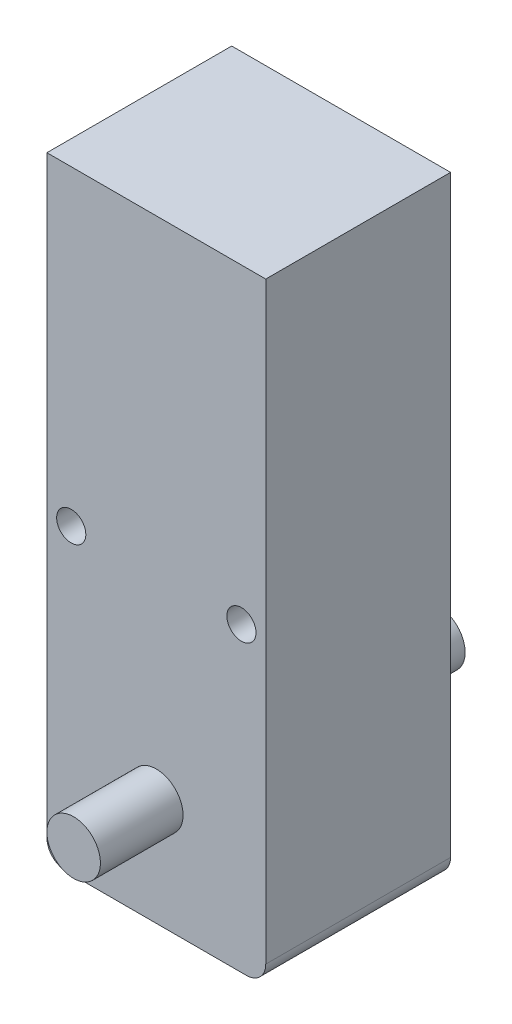
from build123d import *

# Parameters (mm, degrees)
SKETCH1_W                = 22.5
SKETCH1_H                = 19
BOSS_EXTRUDE1_DEPTH      = 63
FILLET1_R                = 2
BOSS_EXTRUDE2_DEPTH      = 10
BOSS_EXTRUDE2_DEPTH_BACK = 27.5
SKETCH2_R                = 2.75
SKETCH3_W                = 5
SKETCH3_H                = 3
BOSS_EXTRUDE3_DEPTH      = 6
SKETCH4_R                = 1.5
CUT_EXTRUDE1_DEPTH       = 10
SKETCH5_R                = 1.5
CUT_EXTRUDE2_DEPTH       = 73.912618935


with BuildPart() as part:
    # Sketch1 → Boss-Extrude1 (new body)
    with BuildSketch(Plane(origin=(0, 0, 0), x_dir=(1, 0, 0), z_dir=(0, 1, 0))):
        with Locations((11.25, 9.5)):
            Rectangle(SKETCH1_W, SKETCH1_H)
    extrude(amount=BOSS_EXTRUDE1_DEPTH)

    # Fillet1
    fillet1_edges = [part.edges().sort_by_distance(p)[0] for p in [
        (22.5, 0, -9.5),
        (0, 0, -9.5),
    ]]
    fillet(fillet1_edges, radius=FILLET1_R)

    # Sketch2 → Boss-Extrude2 (add, two sides: drawn at the far end of the back side and taken through both)
    with BuildSketch(Plane(origin=(0, 0, -19), x_dir=(-1, 0, 0), z_dir=(0, 0, -1)).offset(-BOSS_EXTRUDE2_DEPTH_BACK)):
        with Locations((-11.25, 11)):
            Circle(SKETCH2_R)
    extrude(amount=BOSS_EXTRUDE2_DEPTH + BOSS_EXTRUDE2_DEPTH_BACK)

    # Sketch3 → Boss-Extrude3 (add)
    with BuildSketch(Plane.XZ):
        with Locations((11.25, -8.517818065)):
            Rectangle(SKETCH3_W, SKETCH3_H)
    extrude(amount=BOSS_EXTRUDE3_DEPTH)

    # Sketch4 → Cut-Extrude1 (cut)
    with BuildSketch(Plane(origin=(0, 0, -10.017818065), x_dir=(-1, 0, 0), z_dir=(0, 0, -1))):
        with Locations((-11.25, -3)):
            Circle(SKETCH4_R)
    extrude(amount=-CUT_EXTRUDE1_DEPTH, mode=Mode.SUBTRACT)

    # Sketch5 → Cut-Extrude2 (cut, through all)
    with BuildSketch(Plane.XY):
        with Locations((20, 31)):
            Circle(SKETCH5_R)
        with Locations((2.5, 31)):
            Circle(SKETCH5_R)
    extrude(amount=-CUT_EXTRUDE2_DEPTH, mode=Mode.SUBTRACT)


solid = part.part
